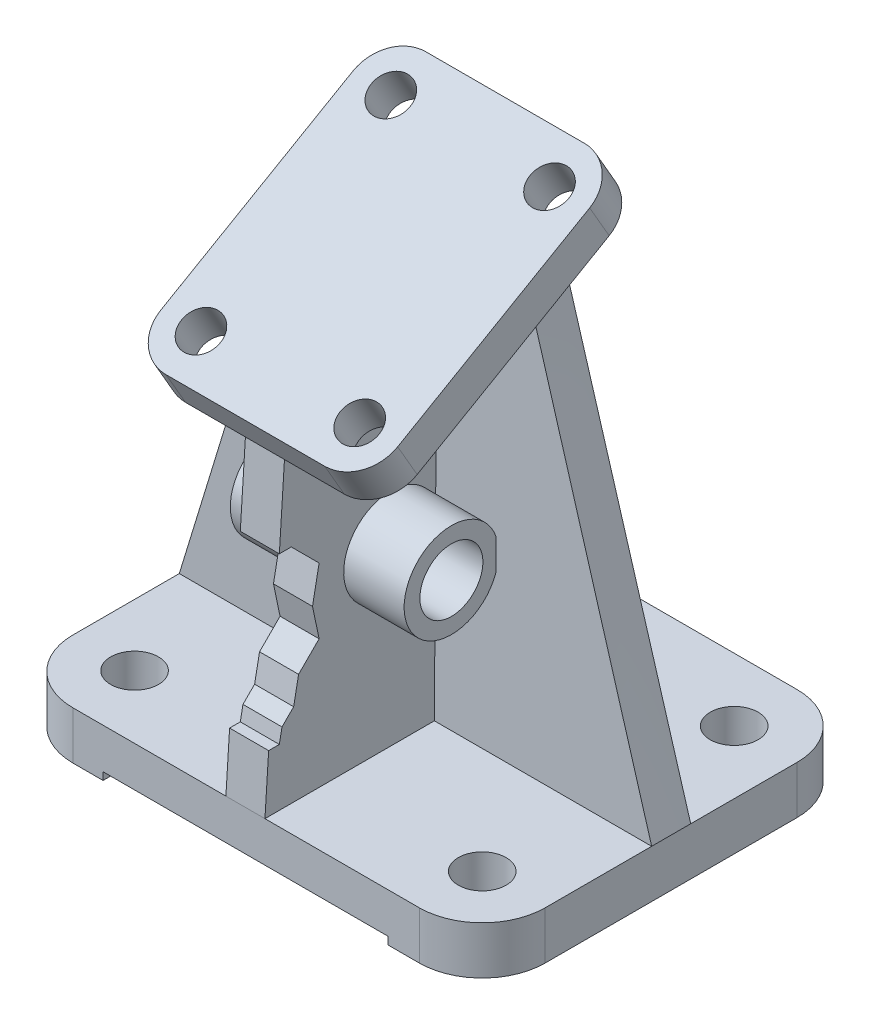
from build123d import *

# Parameters (mm, degrees)
SKETCH2_R                = 4.826
BOSS_EXTRUDE1_DEPTH      = 9.652
CUT_EXTRUDE1_REACH       = 92.443
SKETCH4_W                = 57.404
SKETCH4_H                = 1.524
SKETCH7_R                = 3.937
BOSS_EXTRUDE2_DEPTH      = 7.874
RIB1_REACH               = 125.595
SKETCH11_WALL_W          = 310.061740512
SKETCH11_WALL_H          = 7.874
BOSS_EXTRUDE3_DEPTH      = 14.986
BOSS_EXTRUDE3_DEPTH_BACK = 20.066
SKETCH12_R               = 9.525
CUT_EXTRUDE2_DEPTH       = 126.168470882
CUT_EXTRUDE2_DEPTH_BACK  = 126.168470882
SKETCH12_3_R             = 6.35
CUT_EXTRUDE3_REACH       = 127.168


with BuildPart() as part:
    # Sketch2 → Boss-Extrude1 (new body)
    with BuildSketch(Plane(origin=(0, 0, 0), x_dir=(1, 0, 0), z_dir=(0, 1, 0))):
        with BuildLine():
            Line((35.052, -38.1), (-34.798, -38.1))
            ThreePointArc((-34.798, -38.1), (-43.778256121, -34.380256121), (-47.498, -25.4))
            Line((-47.498, -25.4), (-47.498, 25.4))
            ThreePointArc((-47.498, 25.4), (-43.778256121, 34.380256121), (-34.798, 38.1))
            Line((-34.798, 38.1), (35.052, 38.1))
            ThreePointArc((35.052, 38.1), (44.032256121, 34.380256121), (47.752, 25.4))
            Line((47.752, 25.4), (47.752, -25.4))
            ThreePointArc((47.752, -25.4), (44.032256121, -34.380256121), (35.052, -38.1))
        make_face()
        with Locations((35.052, 25.4)):
            Circle(SKETCH2_R, mode=Mode.SUBTRACT)
        with Locations((35.052, -25.4)):
            Circle(SKETCH2_R, mode=Mode.SUBTRACT)
        with Locations((-35.052, -25.4)):
            Circle(SKETCH2_R, mode=Mode.SUBTRACT)
        with Locations((-35.052, 25.4)):
            Circle(SKETCH2_R, mode=Mode.SUBTRACT)
    extrude(amount=BOSS_EXTRUDE1_DEPTH)

    # Sketch4 → Cut-Extrude1 (cut, up to next)
    with BuildSketch(Plane.XY.offset(38.1), mode=Mode.PRIVATE) as cut_extrude1_sk1:
        with Locations((0, 0.762)):
            Rectangle(SKETCH4_W, SKETCH4_H)
    cut_extrude1_tool1 = extrude(cut_extrude1_sk1.sketch, amount=-CUT_EXTRUDE1_REACH, mode=Mode.PRIVATE) & part.part
    add(cut_extrude1_tool1.solids().sort_by_distance((0, 0.762, 38.1))[0], mode=Mode.SUBTRACT)



with BuildPart() as body_2:
    # Sketch7 → Boss-Extrude2 (new body)
    with BuildSketch(Plane(origin=(0, 74.409783942, 42.960508789), x_dir=(0, 0.499999999999998, -0.8660254037844398), z_dir=(0, -0.8660254037844398, -0.499999999999998))):
        with BuildLine():
            Line((13.486432116, -23.876), (58.190432116, -23.876))
            ThreePointArc((58.190432116, -23.876), (63.758190911, -21.569758795), (66.064432116, -16.002))
            Line((66.064432116, -16.002), (66.064432116, 16.002))
            ThreePointArc((66.064432116, 16.002), (63.758190911, 21.569758795), (58.190432116, 23.876))
            Line((58.190432116, 23.876), (13.486432116, 23.876))
            ThreePointArc((13.486432116, 23.876), (7.918673321, 21.569758795), (5.612432116, 16.002))
            Line((5.612432116, 16.002), (5.612432116, -16.002))
            ThreePointArc((5.612432116, -16.002), (7.918673321, -21.569758795), (13.486432116, -23.876))
        make_face()
        with Locations((13.740432116, 16.002)):
            Circle(SKETCH7_R, mode=Mode.SUBTRACT)
        with Locations((13.740432116, -16.002)):
            Circle(SKETCH7_R, mode=Mode.SUBTRACT)
        with Locations((57.936432116, -16.002)):
            Circle(SKETCH7_R, mode=Mode.SUBTRACT)
        with Locations((57.936432116, 16.002)):
            Circle(SKETCH7_R, mode=Mode.SUBTRACT)
    extrude(amount=BOSS_EXTRUDE2_DEPTH)


with BuildPart() as part_1:
    add(part.part)

    add(body_2.part)  # Loft1 merges body 2
    # Sketch10 → Loft1 section 0
    with BuildSketch(Plane(origin=(0, 67.590699913, 39.023508789), x_dir=(1, 0, 0), z_dir=(0, -0.8660254037844398, -0.49999999999999806))):
        with BuildLine():
            Line((23.876, -48.986339597), (-23.876, -48.986339597))
            Line((-23.876, -48.986339597), (-23.876, -41.13459362))
            Line((-23.876, -41.13459362), (23.876, -41.13459362))
            Line((23.876, -41.13459362), (23.876, -48.986339597))
        make_face()
    # Sketch8 → Loft1 section 1
    with BuildSketch(Plane(origin=(0, 9.652, 0), x_dir=(1, 0, 0), z_dir=(0, 1, 0))):
        with BuildLine():
            Line((47.752, -3.937), (-47.498, -3.937))
            Line((-47.498, -3.937), (-47.498, 3.937))
            Line((-47.498, 3.937), (47.752, 3.937))
            Line((47.752, 3.937), (47.752, -3.937))
        make_face()
    loft()

    # Sketch11 wall → Rib1 (add, up to next)
    with BuildSketch(Plane(origin=(0, 40.024457985, 36.1315), x_dir=(0, 0.997906295589, -0.064676311144), z_dir=(0, 0.064676311144, 0.997906295589)), mode=Mode.PRIVATE) as rib1_sk1:
        Rectangle(SKETCH11_WALL_W, SKETCH11_WALL_H)
    rib1_tool1 = extrude(rib1_sk1.sketch, amount=-RIB1_REACH, mode=Mode.PRIVATE) - part_1.part
    add(rib1_tool1.solids().sort_by_distance((0, 40.024457985, 36.1315))[0])

    # Sketch12 → Boss-Extrude3 (add, two sides: drawn at the far end of the back side and taken through both)
    with BuildSketch(Plane.ZY.offset(3.937).offset(-BOSS_EXTRUDE3_DEPTH_BACK)):
        with Locations((12.7, 44.704)):
            Circle(SKETCH12_R)
    extrude(amount=BOSS_EXTRUDE3_DEPTH + BOSS_EXTRUDE3_DEPTH_BACK)

    # Sketch12<3> → Cut-Extrude2 (cut, two sides: drawn at the far end of the back side and taken through both)
    with BuildSketch(Plane.ZY.offset(3.937).offset(-CUT_EXTRUDE2_DEPTH_BACK)):
        with Locations((12.7, 44.704)):
            Circle(SKETCH12_3_R)
    extrude(amount=CUT_EXTRUDE2_DEPTH + CUT_EXTRUDE2_DEPTH_BACK, mode=Mode.SUBTRACT)

    # Sketch13 → Cut-Extrude3 (cut, up to next)
    with BuildSketch(Plane.ZY.offset(3.937), mode=Mode.PRIVATE) as cut_extrude3_sk1:
        Polygon((32.789961939, 54.446931247), (29.83831511, 51.495284418), (27.177726093, 48.8346954), (28.508020602, 41.928118952), (27.177726093, 35.60023156), (31.314138525, 31.463819128), (32.308134502, 26.303225622), (34.659879511, 23.951480612), (35.196750543, 21.164172387), (41.131268047, 21.164172387), (39.117849331, 54.446931247), align=None)
    cut_extrude3_tool1 = extrude(cut_extrude3_sk1.sketch, amount=-CUT_EXTRUDE3_REACH, mode=Mode.PRIVATE) & part_1.part
    add(cut_extrude3_tool1.solids().sort_by_distance((-3.937, 38.754988, 34.773506))[0], mode=Mode.SUBTRACT)


solid = part_1.part
